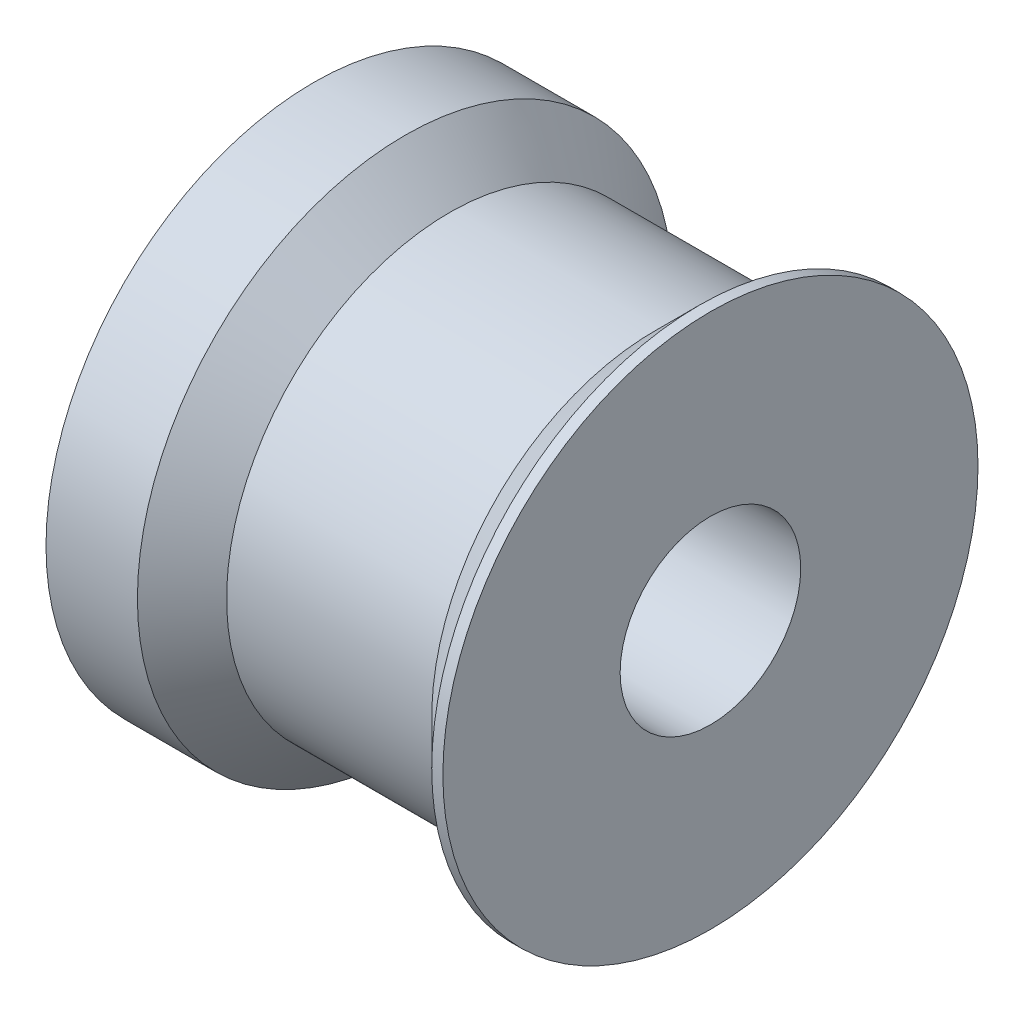
from build123d import *

# Parameters (mm, degrees)
SKETCH3_R           = 2
CUT_EXTRUDE1_DEPTH  = 14.8
CUT_EXTRUDE2_START  = -2
SKETCH4_R           = 4.05
CUT_EXTRUDE2_DEPTH  = 12.8
BOSS_EXTRUDE1_START = 3
SKETCH5_R           = 12
SKETCH5_R_2         = 2
BOSS_EXTRUDE1_DEPTH = 3


with BuildPart() as part:
    # Sketch2 → Revolve1 (revolve)
    with BuildSketch(Plane(origin=(0, 0, 0), x_dir=(1, 0, 0), z_dir=(0, 1, 0))):
        Polygon((-7.7, 12), (-7.7, 0), (-7.1, 0), (7.1, 0), (7.1, 12), (6.6, 12), (4.6, 10), (-4.6, 10), (-6.6, 12), (-7.1, 12), align=None)
    revolve(axis=Axis((7.1, 0, 0), (-1, 0, 0)))

    # Sketch3 → Cut-Extrude1 (cut)
    with BuildSketch(Plane.ZY.offset(7.7)):
        Circle(SKETCH3_R)
    extrude(amount=-CUT_EXTRUDE1_DEPTH, mode=Mode.SUBTRACT)

    # Sketch4 → Cut-Extrude2 (cut)
    with BuildSketch(Plane.ZY.offset(7.7).offset(CUT_EXTRUDE2_START)):
        Circle(SKETCH4_R)
    extrude(amount=-CUT_EXTRUDE2_DEPTH, mode=Mode.SUBTRACT)

    # Sketch5 → Boss-Extrude1 (add)
    with BuildSketch(Plane.ZY.offset(7.7).offset(BOSS_EXTRUDE1_START)):
        with Locations(Location((0, 0, 0), (0, 0, 180))):
            Circle(SKETCH5_R)
        Circle(SKETCH5_R_2, mode=Mode.SUBTRACT)
    extrude(amount=-BOSS_EXTRUDE1_DEPTH)


solid = part.part
